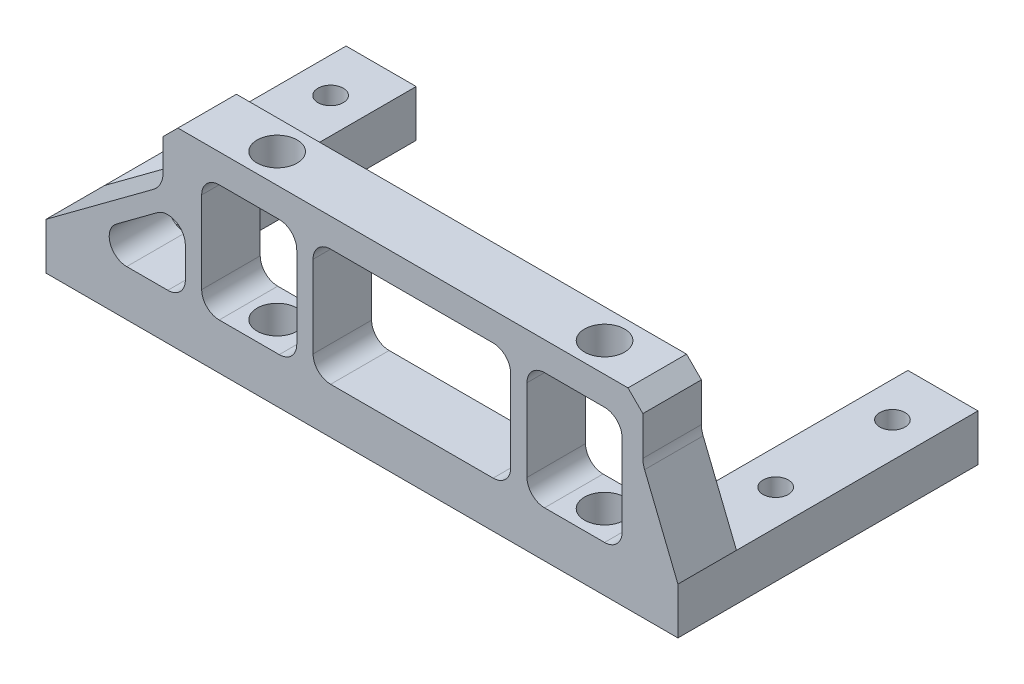
from build123d import *

# Parameters (mm, degrees)
BOSS_EXTRUDE1_DEPTH = 25.654
SKETCH2_W           = 20.6502
SKETCH2_H           = 12.3952
CUT_EXTRUDE1_DEPTH  = 63.010623853
SKETCH3_W           = 42.037
SKETCH3_H           = 20.6502
CUT_EXTRUDE2_DEPTH  = 62.078275718
CUT_EXTRUDE3_DEPTH  = 5.08
SKETCH5_R           = 1.0795
CUT_EXTRUDE4_DEPTH  = 62.078275718
SKETCH6_R           = 1.7145
CUT_EXTRUDE5_DEPTH  = 63.010623853


with BuildPart() as part:
    # Sketch1 → Boss-Extrude1 (new body)
    with BuildSketch(Plane.XY):
        with BuildLine():
            Line((0, 0), (54.0258, 0))
            Line((54.0258, 0), (54.0258, 3.9878))
            Line((54.0258, 3.9878), (51.176616962, 11.038320738))
            ThreePointArc((51.176616962, 11.038320738), (51.065947457, 11.411860999), (51.0286, 11.799656349))
            Line((51.0286, 11.799656349), (51.0286, 15.113))
            Line((51.0286, 15.113), (49.7586, 16.383))
            Line((49.7586, 16.383), (11.2776, 16.383))
            Line((11.2776, 16.383), (10.0076, 15.113))
            Line((10.0076, 15.113), (10.0076, 12.427861529))
            ThreePointArc((10.0076, 12.427861529), (9.790474401, 11.513938717), (9.185498713, 10.795326965))
            Line((9.185498713, 10.795326965), (0, 3.9878))
            Line((0, 3.9878), (0, 0))
        make_face()
    extrude(amount=-BOSS_EXTRUDE1_DEPTH)

    # Sketch2 → Cut-Extrude1 (cut, through all)
    with BuildSketch(Plane(origin=(54.0258, 0, 0), x_dir=(0, 0, -1), z_dir=(1, 0, 0))):
        with Locations((15.3289, 10.1854)):
            Rectangle(SKETCH2_W, SKETCH2_H)
    extrude(amount=-CUT_EXTRUDE1_DEPTH, mode=Mode.SUBTRACT)

    # Sketch3 → Cut-Extrude2 (cut, through all)
    with BuildSketch(Plane(origin=(0, 3.9878, 0), x_dir=(1, 0, 0), z_dir=(0, 1, 0))):
        with Locations((27.0129, 15.3289)):
            Rectangle(SKETCH3_W, SKETCH3_H)
    extrude(amount=-CUT_EXTRUDE2_DEPTH, mode=Mode.SUBTRACT)

    # Sketch4 → Cut-Extrude3 (cut)
    with BuildSketch(Plane.XY):
        with BuildLine():
            Line((6.901956547, 3.937), (10.414, 3.937))
            ThreePointArc((10.414, 3.937), (11.473670222, 4.375929778), (11.9126, 5.4356))
            Line((11.9126, 5.4356), (11.9126, 8.038434234))
            ThreePointArc((11.9126, 8.038434234), (11.088018074, 9.376904105), (9.521699699, 9.242428475))
            Line((9.521699699, 9.242428475), (6.009656246, 6.639594241))
            ThreePointArc((6.009656246, 6.639594241), (5.478912674, 4.965761629), (6.901956547, 3.937))
        make_face()
        with BuildLine():
            Line((47.752, 13.9446), (42.6212, 13.9446))
            ThreePointArc((42.6212, 13.9446), (41.561529778, 13.505670222), (41.1226, 12.446))
            Line((41.1226, 12.446), (41.1226, 5.4356))
            ThreePointArc((41.1226, 5.4356), (41.561529778, 4.375929778), (42.6212, 3.937))
            Line((42.6212, 3.937), (47.752, 3.937))
            ThreePointArc((47.752, 3.937), (48.811670222, 4.375929778), (49.2506, 5.4356))
            Line((49.2506, 5.4356), (49.2506, 12.446))
            ThreePointArc((49.2506, 12.446), (48.811670222, 13.505670222), (47.752, 13.9446))
        make_face()
        with BuildLine():
            Line((13.3096, 12.446), (13.3096, 5.4356))
            ThreePointArc((13.3096, 5.4356), (13.748529778, 4.375929778), (14.8082, 3.937))
            Line((14.8082, 3.937), (19.939, 3.937))
            ThreePointArc((19.939, 3.937), (20.998670222, 4.375929778), (21.4376, 5.4356))
            Line((21.4376, 5.4356), (21.4376, 12.446))
            ThreePointArc((21.4376, 12.446), (20.998670222, 13.505670222), (19.939, 13.9446))
            Line((19.939, 13.9446), (14.8082, 13.9446))
            ThreePointArc((14.8082, 13.9446), (13.748529778, 13.505670222), (13.3096, 12.446))
        make_face()
        with BuildLine():
            Line((22.8346, 12.446), (22.8346, 5.4356))
            ThreePointArc((22.8346, 5.4356), (23.273529778, 4.375929778), (24.3332, 3.937))
            Line((24.3332, 3.937), (38.227, 3.937))
            ThreePointArc((38.227, 3.937), (39.286670222, 4.375929778), (39.7256, 5.4356))
            Line((39.7256, 5.4356), (39.7256, 12.446))
            ThreePointArc((39.7256, 12.446), (39.286670222, 13.505670222), (38.227, 13.9446))
            Line((38.227, 13.9446), (24.3332, 13.9446))
            ThreePointArc((24.3332, 13.9446), (23.273529778, 13.505670222), (22.8346, 12.446))
        make_face()
    extrude(amount=-CUT_EXTRUDE3_DEPTH, mode=Mode.SUBTRACT)

    # Sketch5 → Cut-Extrude4 (cut, through all)
    with BuildSketch(Plane(origin=(0, 3.9878, 0), x_dir=(1, 0, 0), z_dir=(0, 1, 0))):
        with Locations(Location((51.0286, 21.336, 0), (0, 0, 270))):
            Circle(SKETCH5_R)
        with Locations(Location((51.0286, 11.3538, 0), (0, 0, 270))):
            Circle(SKETCH5_R)
        with Locations(Location((2.9972, 11.3538, 0), (0, 0, 90))):
            Circle(SKETCH5_R)
        with Locations(Location((2.9972, 21.336, 0), (0, 0, 90))):
            Circle(SKETCH5_R)
    extrude(amount=-CUT_EXTRUDE4_DEPTH, mode=Mode.SUBTRACT)

    # Sketch6 → Cut-Extrude5 (cut, through all)
    with BuildSketch(Plane.XZ):
        with Locations(Location((45.2501, -2.5019, 0), (0, 0, 270))):
            Circle(SKETCH6_R)
        with Locations(Location((17.2593, -2.5019, 0), (0, 0, 270))):
            Circle(SKETCH6_R)
    extrude(amount=-CUT_EXTRUDE5_DEPTH, mode=Mode.SUBTRACT)


solid = part.part
